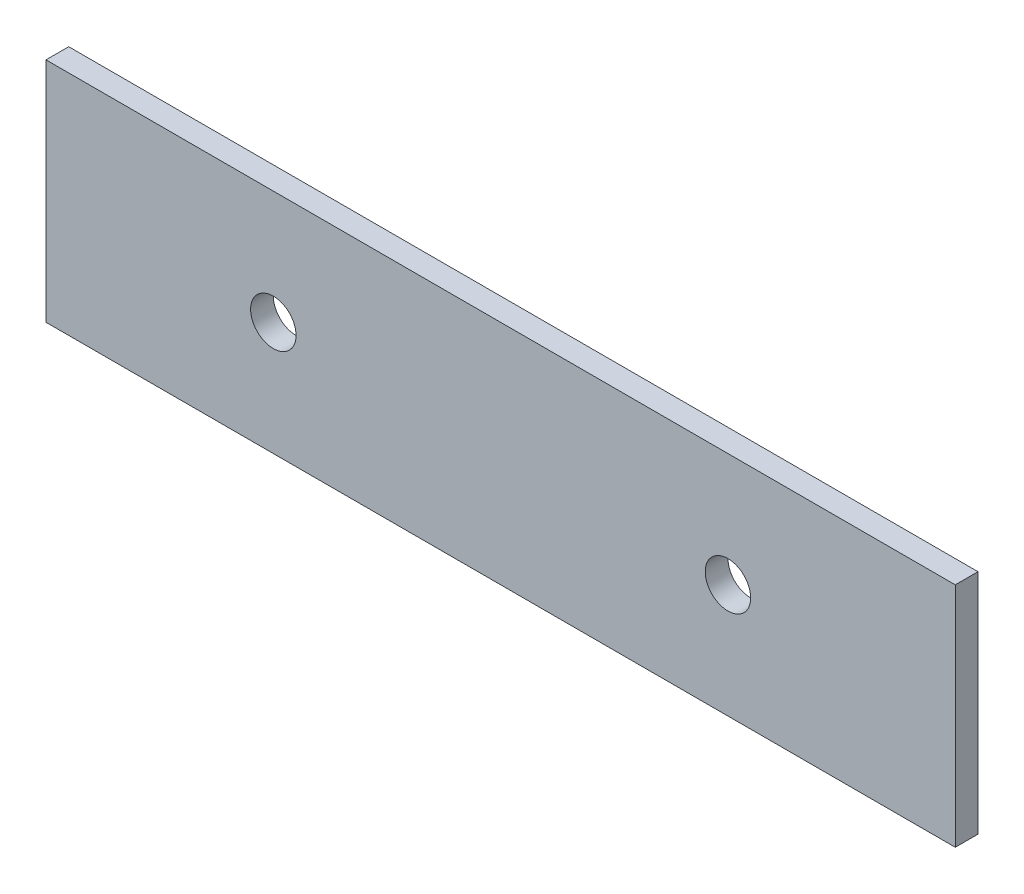
from build123d import *

# Parameters (mm, degrees)
SKETCH1_W           = 80
SKETCH1_H           = 20
BOSS_EXTRUDE1_DEPTH = 2
SKETCH2_R           = 2
CUT_EXTRUDE1_DEPTH  = 42.279534881


with BuildPart() as part:
    # Sketch1 → Boss-Extrude1 (new body)
    with BuildSketch(Plane.XY):
        Rectangle(SKETCH1_W, SKETCH1_H)
    extrude(amount=BOSS_EXTRUDE1_DEPTH)

    # Sketch2 → Cut-Extrude1 (cut, through all)
    with BuildSketch(Plane.XY.offset(2)):
        with Locations((-20, 0)):
            Circle(SKETCH2_R)
        with Locations((20, 0)):
            Circle(SKETCH2_R)
    extrude(amount=-CUT_EXTRUDE1_DEPTH, mode=Mode.SUBTRACT)


solid = part.part
